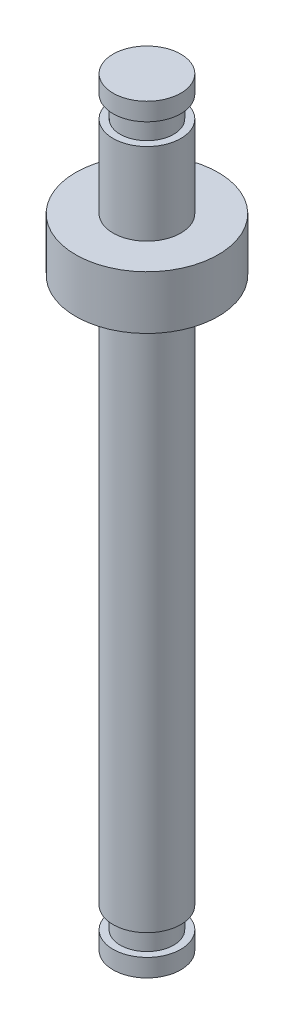
from build123d import *


with BuildPart() as part:
    # Sketch1 → Revolve1 (revolve)
    with BuildSketch(Plane(origin=(0, 0, 0), x_dir=(-1, 0, 0), z_dir=(0, 0, -1)), mode=Mode.PRIVATE) as revolve1_sk:
        Polygon((-1.9, -35.3), (0, -35.3), (0, 7.3), (-1.9, 7.3), (-1.9, 6.3), (-1.5, 6.3), (-1.5, 5.1), (-1.9, 5.1), (-1.9, 0.5), (-4, 0.5), (-4, -2.5), (-1.9, -2.5), (-1.9, -33.1), (-1.5, -33.1), (-1.5, -34.3), (-1.9, -34.3), align=None)
    revolve(revolve1_sk.sketch.rotate(Axis((0, -35.3, 0), (0, 1, 0)), 180), axis=Axis((0, -35.3, 0), (0, 1, 0)))


solid = part.part
